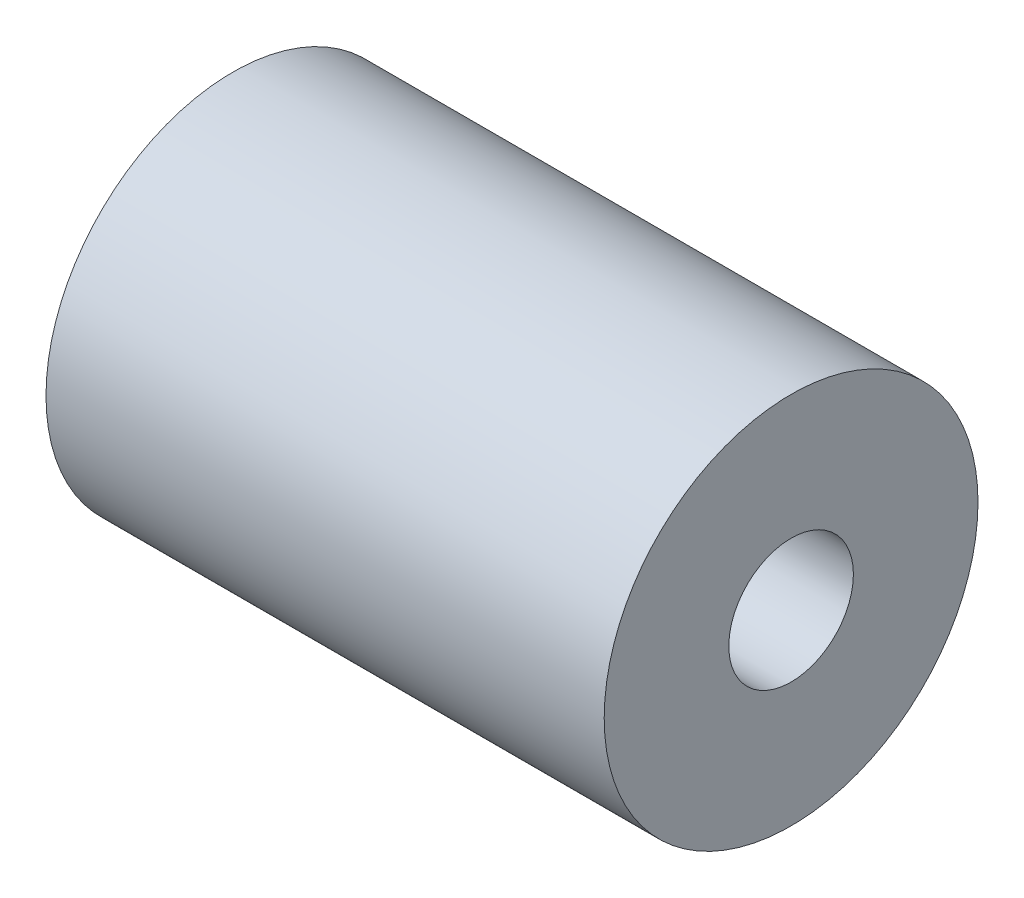
from build123d import *

# Parameters (mm, degrees)
SKETCH1_R           = 9.525
SKETCH1_R_2         = 3.175
BOSS_EXTRUDE1_DEPTH = 28.448


with BuildPart() as part:
    # Sketch1 → Boss-Extrude1 (new body)
    with BuildSketch(Plane(origin=(0, 0, 0), x_dir=(0, 0, -1), z_dir=(1, 0, 0))):
        Circle(SKETCH1_R)
        Circle(SKETCH1_R_2, mode=Mode.SUBTRACT)
    extrude(amount=BOSS_EXTRUDE1_DEPTH)


solid = part.part
